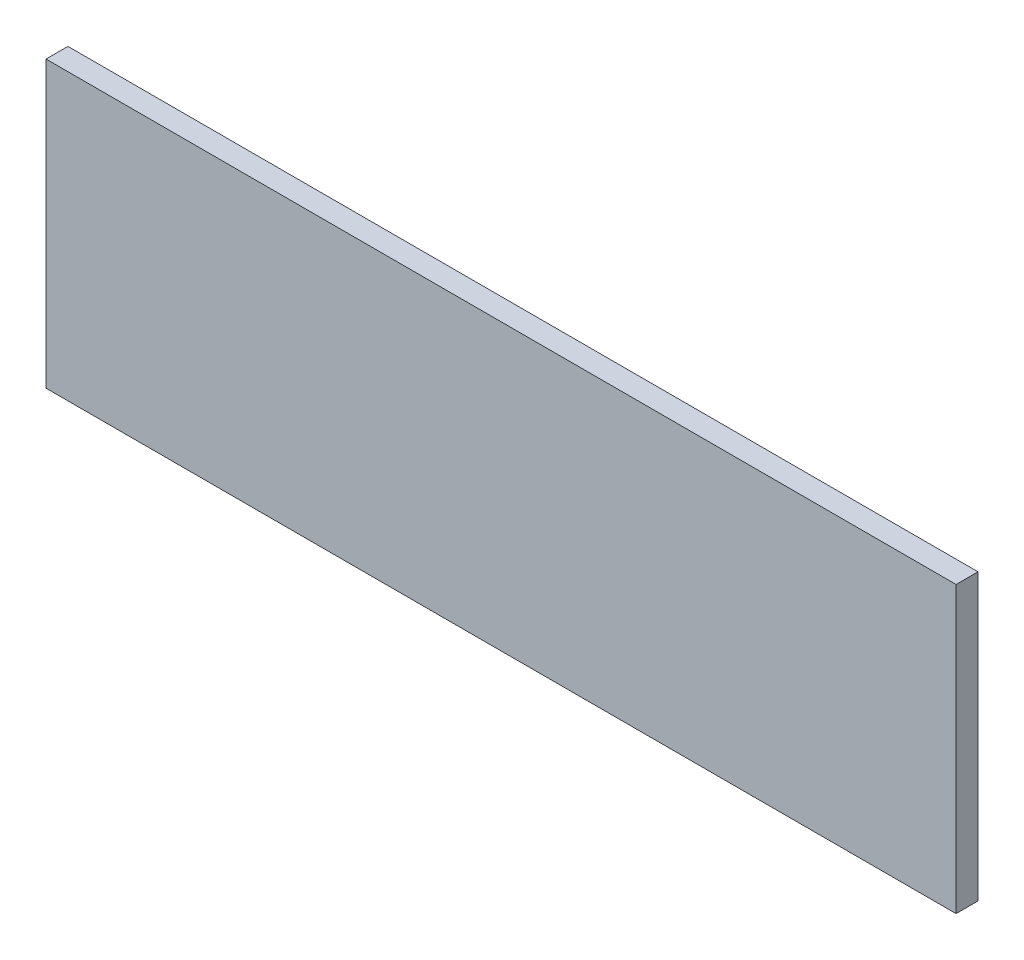
from build123d import *

# Parameters (mm, degrees)
SKETCH_1_W      = 83
SKETCH_1_H      = 26
EXTRUDE_1_DEPTH = 2


with BuildPart() as part:
    # 草图1 → 凸台-拉伸1 (new body)
    with BuildSketch(Plane.XY):
        Rectangle(SKETCH_1_W, SKETCH_1_H)
    extrude(amount=EXTRUDE_1_DEPTH)


solid = part.part
